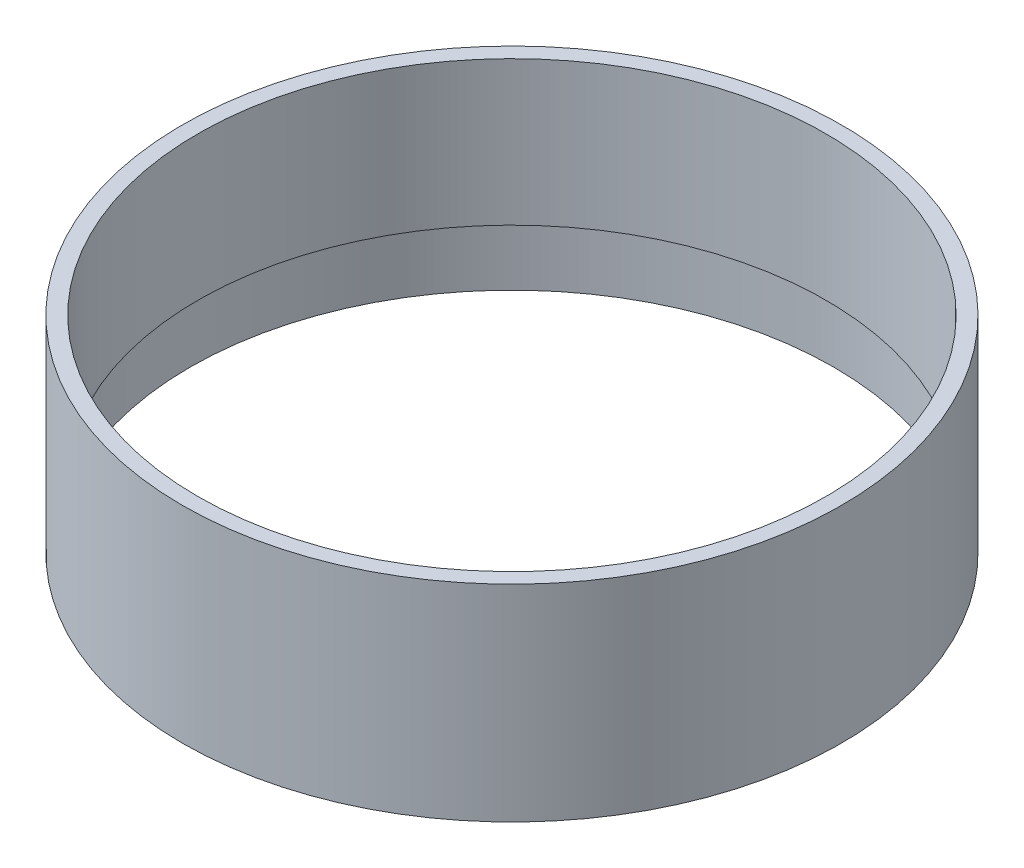
from build123d import *

# Parameters (mm, degrees)
SKETCH1_R           = 16
SKETCH1_R_2         = 15.25
BOSS_EXTRUDE1_DEPTH = 10
SKETCH1_6_R         = 15.625
CUT_EXTRUDE1_DEPTH  = 3


with BuildPart() as part:
    # Sketch1 → Boss-Extrude1 (new body)
    with BuildSketch(Plane(origin=(0, 0, 0), x_dir=(1, 0, 0), z_dir=(0, 1, 0))):
        Circle(SKETCH1_R)
        Circle(SKETCH1_R_2, mode=Mode.SUBTRACT)
    extrude(amount=BOSS_EXTRUDE1_DEPTH)

    # Sketch1<6> → Cut-Extrude1 (cut)
    with BuildSketch(Plane(origin=(0, 0, 0), x_dir=(1, 0, 0), z_dir=(0, 1, 0))):
        Circle(SKETCH1_6_R)
    extrude(amount=CUT_EXTRUDE1_DEPTH, mode=Mode.SUBTRACT)


solid = part.part
